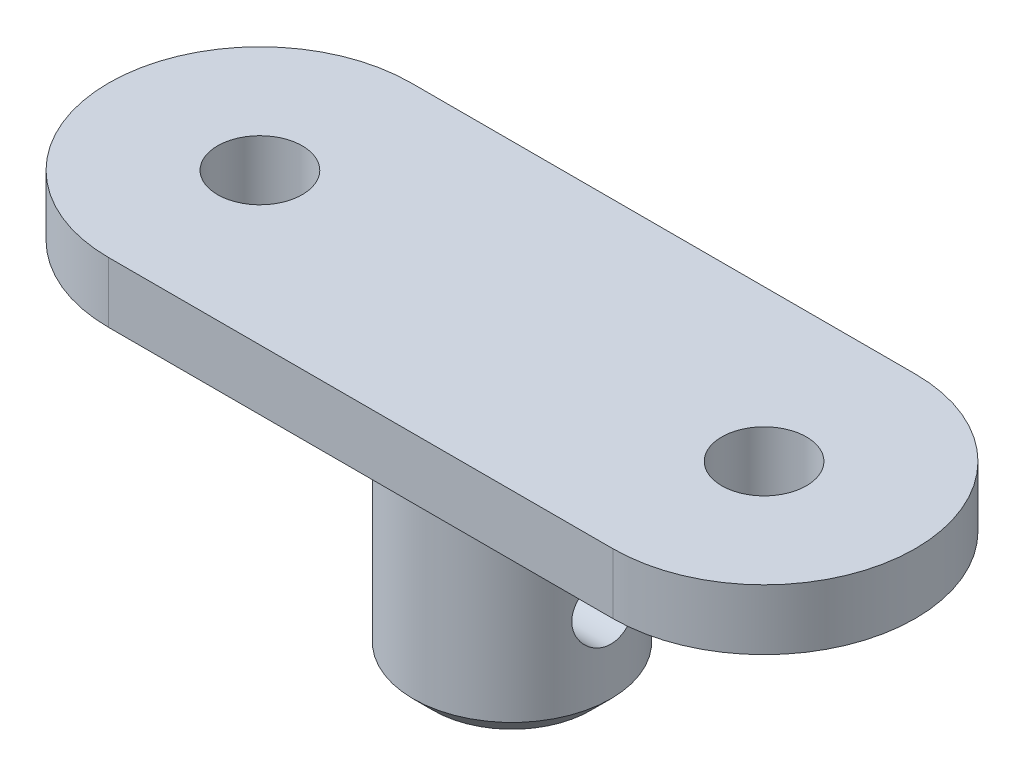
from build123d import *

# Parameters (mm, degrees)
SKETCH_1_R         = 4.9
EXTRUDE_1_DEPTH    = 15
HOLE_WIZARD_M4_1_D = 3.3
CHAMFER_1_SIZE     = 1
SKETCH_6_R         = 2.1
EXTRUDE_2_DEPTH    = 3


with BuildPart() as part:
    # 草图1 → 凸台-拉伸1 (new body)
    with BuildSketch(Plane(origin=(0, 0, 0), x_dir=(1, 0, 0), z_dir=(0, 1, 0))):
        with Locations(Location((0, 0, 0), (0, 0, 270))):
            Circle(SKETCH_1_R)
    extrude(amount=EXTRUDE_1_DEPTH)

    # M4 螺纹孔1 (through all)
    with Locations(Plane(origin=(4.9, 0, 0), x_dir=(0, 0, -1), z_dir=(1, 0, 0))):
        with Locations((0, 5)):
            Hole(HOLE_WIZARD_M4_1_D / 2)

    # 倒角1
    chamfer_1_edges = [part.edges().sort_by_distance(p)[0] for p in [
        (0, 0, -4.9),
    ]]
    chamfer(chamfer_1_edges, length=CHAMFER_1_SIZE)

    # 草图6 → 凸台-拉伸2 (add)
    with BuildSketch(Plane(origin=(0, 15, 0), x_dir=(1, 0, 0), z_dir=(0, 1, 0))):
        with BuildLine():
            Line((-12.5, 7.5), (12.5, 7.5))
            ThreePointArc((12.5, 7.5), (20, 0), (12.5, -7.5))
            Line((12.5, -7.5), (-12.5, -7.5))
            ThreePointArc((-12.5, -7.5), (-20, 0), (-12.5, 7.5))
        make_face()
        with Locations(Location((-12.5, 0, 0), (0, 0, 270))):
            Circle(SKETCH_6_R, mode=Mode.SUBTRACT)
        with Locations(Location((12.5, 0, 0), (0, 0, 270))):
            Circle(SKETCH_6_R, mode=Mode.SUBTRACT)
    extrude(amount=-EXTRUDE_2_DEPTH)


solid = part.part
